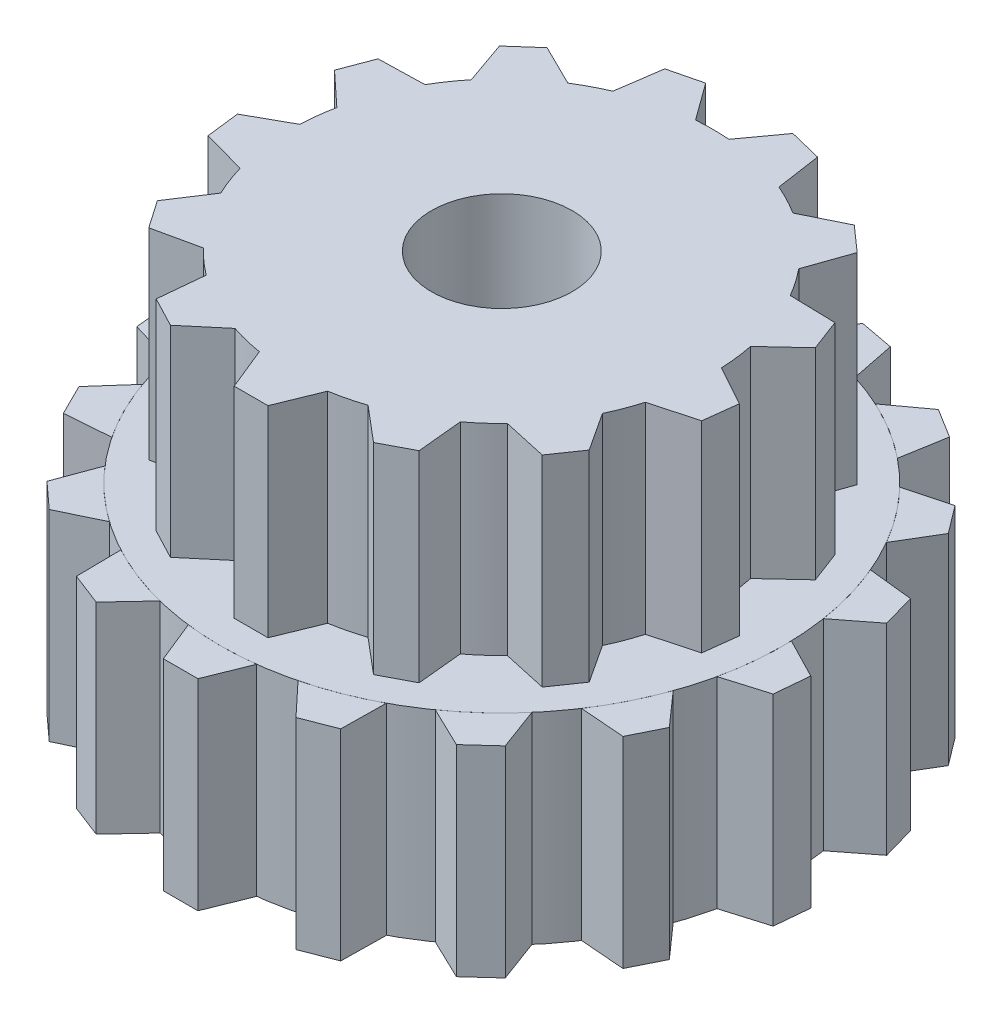
from build123d import *

# Parameters (mm, degrees)
SKETCH1_R            = 3.5
BOSS_EXTRUDE1_DEPTH  = 5
SKETCH12_R           = 10.5
SKETCH12_R_2         = 3.5
BOSS_EXTRUDE6_DEPTH  = 5
BOSS_EXTRUDE9_DEPTH  = 5
CIRPATTERN2_COUNT    = 13
CUT_EXTRUDE1_START   = -10
SKETCH14_R           = 3.5
CUT_EXTRUDE1_DEPTH   = 10
SKETCH17_R           = 10.5
SKETCH17_R_2         = 3.5
BOSS_EXTRUDE10_DEPTH = 5
SKETCH20_R           = 14
SKETCH20_R_2         = 3.5
BOSS_EXTRUDE11_DEPTH = 10
BOSS_EXTRUDE12_DEPTH = 10
CIRPATTERN3_COUNT    = 17
BOSS_EXTRUDE13_DEPTH = 5


with BuildPart() as part:
    # Sketch1 → Boss-Extrude1 (new body)
    with BuildSketch(Plane(origin=(0, 0, 0), x_dir=(1, 0, 0), z_dir=(0, 1, 0))):
        with Locations(Location((0, 0, 0), (0, 0, 270))):
            Circle(SKETCH1_R)
    extrude(amount=BOSS_EXTRUDE1_DEPTH)

    # Sketch14 → Cut-Extrude1 (cut)
    with BuildSketch(Plane(origin=(0, 5, 0), x_dir=(1, 0, 0), z_dir=(0, 1, 0)).offset(CUT_EXTRUDE1_START)):
        with Locations(Location((0, 0, 0), (0, 0, 90))):
            Circle(SKETCH14_R)
    extrude(amount=CUT_EXTRUDE1_DEPTH, mode=Mode.SUBTRACT)


with BuildPart() as body_2:
    # Sketch12 → Boss-Extrude6 (new body)
    with BuildSketch(Plane(origin=(0, 5, 0), x_dir=(-1, 0, 0), z_dir=(0, -1, 0))):
        with Locations(Location((0, 0, 0), (0, 0, 90))):
            Circle(SKETCH12_R)
        with Locations(Location((0, 0, 0), (0, 0, 90))):
            Circle(SKETCH12_R_2, mode=Mode.SUBTRACT)
    extrude(amount=BOSS_EXTRUDE6_DEPTH)



with BuildPart() as body_3:
    # Sketch13 → Boss-Extrude9 (new body)
    with BuildSketch(Plane.XZ):
        with BuildLine():
            Line((1.7, 10.361467078), (0.84, 12.471744064))
            Line((0.84, 12.471744064), (-0.84, 12.471744064))
            Line((-0.84, 12.471744064), (-1.7, 10.361467078))
            ThreePointArc((-1.7, 10.361467078), (0, 10.5), (1.7, 10.361467078))
        make_face()
    extrude(amount=-BOSS_EXTRUDE9_DEPTH)


with BuildPart() as cirpattern2_1:
    # CirPattern2: pattern copy
    add(body_3.part.rotate(Axis((0, 0, 0), (0, 1, 0)), 1 * 360 / CIRPATTERN2_COUNT))


with BuildPart() as cirpattern2_2:
    # CirPattern2: pattern copy
    add(body_3.part.rotate(Axis((0, 0, 0), (0, 1, 0)), 2 * 360 / CIRPATTERN2_COUNT))


with BuildPart() as cirpattern2_3:
    # CirPattern2: pattern copy
    add(body_3.part.rotate(Axis((0, 0, 0), (0, 1, 0)), 3 * 360 / CIRPATTERN2_COUNT))


with BuildPart() as cirpattern2_4:
    # CirPattern2: pattern copy
    add(body_3.part.rotate(Axis((0, 0, 0), (0, 1, 0)), 4 * 360 / CIRPATTERN2_COUNT))


with BuildPart() as cirpattern2_5:
    # CirPattern2: pattern copy
    add(body_3.part.rotate(Axis((0, 0, 0), (0, 1, 0)), 5 * 360 / CIRPATTERN2_COUNT))


with BuildPart() as cirpattern2_6:
    # CirPattern2: pattern copy
    add(body_3.part.rotate(Axis((0, 0, 0), (0, 1, 0)), 6 * 360 / CIRPATTERN2_COUNT))


with BuildPart() as cirpattern2_7:
    # CirPattern2: pattern copy
    add(body_3.part.rotate(Axis((0, 0, 0), (0, 1, 0)), 7 * 360 / CIRPATTERN2_COUNT))


with BuildPart() as cirpattern2_8:
    # CirPattern2: pattern copy
    add(body_3.part.rotate(Axis((0, 0, 0), (0, 1, 0)), 8 * 360 / CIRPATTERN2_COUNT))


with BuildPart() as cirpattern2_9:
    # CirPattern2: pattern copy
    add(body_3.part.rotate(Axis((0, 0, 0), (0, 1, 0)), 9 * 360 / CIRPATTERN2_COUNT))


with BuildPart() as cirpattern2_10:
    # CirPattern2: pattern copy
    add(body_3.part.rotate(Axis((0, 0, 0), (0, 1, 0)), 10 * 360 / CIRPATTERN2_COUNT))


with BuildPart() as cirpattern2_11:
    # CirPattern2: pattern copy
    add(body_3.part.rotate(Axis((0, 0, 0), (0, 1, 0)), 11 * 360 / CIRPATTERN2_COUNT))


with BuildPart() as cirpattern2_12:
    # CirPattern2: pattern copy
    add(body_3.part.rotate(Axis((0, 0, 0), (0, 1, 0)), 12 * 360 / CIRPATTERN2_COUNT))


with BuildPart() as body_2_1:
    add(body_2.part)

    add(body_3.part)  # Boss-Extrude10 merges body 3

    add(cirpattern2_4.part)  # Boss-Extrude10 merges CirPattern2_4

    add(cirpattern2_5.part)  # Boss-Extrude10 merges CirPattern2_5

    add(cirpattern2_6.part)  # Boss-Extrude10 merges CirPattern2_6

    add(cirpattern2_7.part)  # Boss-Extrude10 merges CirPattern2_7

    add(cirpattern2_8.part)  # Boss-Extrude10 merges CirPattern2_8

    add(cirpattern2_9.part)  # Boss-Extrude10 merges CirPattern2_9

    add(cirpattern2_10.part)  # Boss-Extrude10 merges CirPattern2_10

    add(cirpattern2_11.part)  # Boss-Extrude10 merges CirPattern2_11

    add(cirpattern2_12.part)  # Boss-Extrude10 merges CirPattern2_12
    # Sketch17 → Boss-Extrude10 (add)
    # profile 1 of 11: a face of its own
    with BuildSketch(Plane.XZ):
        Circle(SKETCH17_R)
        with Locations(Location((0, 0, 0), (0, 0, 270))):
            Circle(SKETCH17_R_2, mode=Mode.SUBTRACT)
    # profile 2 of 11: a face of its own
    with BuildSketch(Plane.XZ):
        with BuildLine():
            ThreePointArc((-1.7, 10.361467078), (0, 10.5), (1.7, 10.361467078))
            Line((1.7, 10.361467078), (0.84, 12.471744064))
            Line((0.84, 12.471744064), (-0.84, 12.471744064))
            Line((-0.84, 12.471744064), (-1.7, 10.361467078))
        make_face()
    # profile 3 of 11: a face of its own
    with BuildSketch(Plane.XZ):
        with BuildLine():
            ThreePointArc((-6.320489091, 8.384594066), (-4.879593306, 9.297288269), (-3.309938604, 9.964652851))
            Line((-3.309938604, 9.964652851), (-5.052125401, 11.433548396))
            Line((-5.052125401, 11.433548396), (-6.539691524, 10.652813467))
            Line((-6.539691524, 10.652813467), (-6.320489091, 8.384594066))
        make_face()
    # profile 4 of 11: a face of its own
    with BuildSketch(Plane.XZ):
        with BuildLine():
            Line((-10.741218532, 6.393451686), (-9.493030301, 4.486911599))
            ThreePointArc((-9.493030301, 4.486911599), (-8.641330592, 5.964679841), (-7.561610162, 7.285056743))
            Line((-7.561610162, 7.285056743), (-9.786869757, 7.77606458))
            Line((-9.786869757, 7.77606458), (-10.741218532, 6.393451686))
        make_face()
    # profile 5 of 11: a face of its own
    with BuildSketch(Plane.XZ):
        with BuildLine():
            Line((-12.482061819, 0.669427172), (-10.490832673, -0.438668242))
            ThreePointArc((-10.490832673, -0.438668242), (-10.423443178, 1.265635143), (-10.08100796, 2.93654193))
            Line((-10.08100796, 2.93654193), (-12.279560196, 2.337178081))
            Line((-12.279560196, 2.337178081), (-12.482061819, 0.669427172))
        make_face()
    # profile 6 of 11: a face of its own
    with BuildSketch(Plane.XZ):
        with BuildLine():
            Line((-11.363415169, -5.207955039), (-9.085311708, -5.263754475))
            ThreePointArc((-9.085311708, -5.263754475), (-9.817670548, -3.723351314), (-10.290968324, -2.08469925))
            Line((-10.290968324, -2.08469925), (-11.95915138, -3.637127751))
            Line((-11.95915138, -3.637127751), (-11.363415169, -5.207955039))
        make_face()
    # profile 7 of 11: a face of its own
    with BuildSketch(Plane.XZ):
        with BuildLine():
            Line((-7.641547048, -9.892257513), (-5.59845532, -8.882977993))
            ThreePointArc((-5.59845532, -8.882977993), (-6.962787912, -7.859362856), (-8.143391864, -6.628360955))
            Line((-8.143391864, -6.628360955), (-8.899045105, -8.778211447))
            Line((-8.899045105, -8.778211447), (-7.641547048, -9.892257513))
        make_face()
    # profile 8 of 11: a face of its own
    with BuildSketch(Plane.XZ):
        with BuildLine():
            Line((-2.169092589, -12.310363006), (-0.829060287, -10.467218305))
            ThreePointArc((-0.829060287, -10.467218305), (-2.512814475, -10.194889083), (-4.130262466, -9.653545046))
            Line((-4.130262466, -9.653545046), (-3.800274842, -11.90831269))
            Line((-3.800274842, -11.90831269), (-2.169092589, -12.310363006))
        make_face()
    # profile 9 of 11: a face of its own
    with BuildSketch(Plane.XZ):
        with BuildLine():
            Line((0.829060287, -10.467218305), (2.169092589, -12.310363006))
            Line((2.169092589, -12.310363006), (3.800274842, -11.90831269))
            Line((3.800274842, -11.90831269), (4.130262466, -9.653545046))
            ThreePointArc((4.130262466, -9.653545046), (2.512814475, -10.194889083), (0.829060287, -10.467218305))
        make_face()
    # profile 10 of 11: a face of its own
    with BuildSketch(Plane.XZ):
        with BuildLine():
            ThreePointArc((8.143391864, -6.628360955), (6.962787912, -7.859362856), (5.59845532, -8.882977993))
            Line((5.59845532, -8.882977993), (7.641547048, -9.892257513))
            Line((7.641547048, -9.892257513), (8.899045105, -8.778211447))
            Line((8.899045105, -8.778211447), (8.143391864, -6.628360955))
        make_face()
    # profile 11 of 11: a face of its own
    with BuildSketch(Plane.XZ):
        with BuildLine():
            ThreePointArc((10.290968324, -2.08469925), (9.817670548, -3.723351314), (9.085311708, -5.263754475))
            Line((9.085311708, -5.263754475), (11.363415169, -5.207955039))
            Line((11.363415169, -5.207955039), (11.95915138, -3.637127751))
            Line((11.95915138, -3.637127751), (10.290968324, -2.08469925))
        make_face()
    extrude(amount=BOSS_EXTRUDE10_DEPTH)

    # Sketch20 → Boss-Extrude11 (add)
    with BuildSketch(Plane.XZ.offset(5)):
        with Locations(Location((0, 0, 0), (0, 0, 270))):
            Circle(SKETCH20_R)
        with Locations(Location((0, 0, 0), (0, 0, 270))):
            Circle(SKETCH20_R_2, mode=Mode.SUBTRACT)
    extrude(amount=BOSS_EXTRUDE11_DEPTH)


    add(cirpattern2_1.part)  # Boss-Extrude13 merges CirPattern2_1

    add(cirpattern2_2.part)  # Boss-Extrude13 merges CirPattern2_2

    add(cirpattern2_3.part)  # Boss-Extrude13 merges CirPattern2_3
    # Sketch25 → Boss-Extrude13 (add)
    with BuildSketch(Plane.XZ):
        with BuildLine():
            Line((6.320489091, 8.384594066), (6.539691524, 10.652813467))
            Line((6.539691524, 10.652813467), (5.052125401, 11.433548396))
            Line((5.052125401, 11.433548396), (3.309938604, 9.964652851))
            ThreePointArc((3.309938604, 9.964652851), (4.879593306, 9.297288269), (6.320489091, 8.384594066))
        make_face()
        with BuildLine():
            Line((9.493030301, 4.486911599), (10.741218532, 6.393451686))
            Line((10.741218532, 6.393451686), (9.786869757, 7.77606458))
            Line((9.786869757, 7.77606458), (7.561610162, 7.285056743))
            ThreePointArc((7.561610162, 7.285056743), (8.641330592, 5.964679841), (9.493030301, 4.486911599))
        make_face()
        with BuildLine():
            Line((10.490832673, -0.438668242), (12.482061819, 0.669427172))
            Line((12.482061819, 0.669427172), (12.279560196, 2.337178081))
            Line((12.279560196, 2.337178081), (10.08100796, 2.93654193))
            ThreePointArc((10.08100796, 2.93654193), (10.423443178, 1.265635143), (10.490832673, -0.438668242))
        make_face()
    extrude(amount=BOSS_EXTRUDE13_DEPTH)


with BuildPart() as body_5:
    # Sketch21 → Boss-Extrude12 (new body)
    with BuildSketch(Plane.XZ.offset(15)):
        with BuildLine():
            Line((1.7, 13.896402412), (0.86, 15.976870782))
            Line((0.86, 15.976870782), (-0.86, 15.976870782))
            Line((-0.86, 15.976870782), (-1.7, 13.896402412))
            ThreePointArc((-1.7, 13.896402412), (0, 14), (1.7, 13.896402412))
        make_face()
    extrude(amount=-BOSS_EXTRUDE12_DEPTH)


with BuildPart() as cirpattern3_1:
    # CirPattern3: pattern copy
    add(body_5.part.rotate(Axis((0, 0, 0), (0, 1, 0)), 1 * 360 / CIRPATTERN3_COUNT))


with BuildPart() as cirpattern3_2:
    # CirPattern3: pattern copy
    add(body_5.part.rotate(Axis((0, 0, 0), (0, 1, 0)), 2 * 360 / CIRPATTERN3_COUNT))


with BuildPart() as cirpattern3_3:
    # CirPattern3: pattern copy
    add(body_5.part.rotate(Axis((0, 0, 0), (0, 1, 0)), 3 * 360 / CIRPATTERN3_COUNT))


with BuildPart() as cirpattern3_4:
    # CirPattern3: pattern copy
    add(body_5.part.rotate(Axis((0, 0, 0), (0, 1, 0)), 4 * 360 / CIRPATTERN3_COUNT))


with BuildPart() as cirpattern3_5:
    # CirPattern3: pattern copy
    add(body_5.part.rotate(Axis((0, 0, 0), (0, 1, 0)), 5 * 360 / CIRPATTERN3_COUNT))


with BuildPart() as cirpattern3_6:
    # CirPattern3: pattern copy
    add(body_5.part.rotate(Axis((0, 0, 0), (0, 1, 0)), 6 * 360 / CIRPATTERN3_COUNT))


with BuildPart() as cirpattern3_7:
    # CirPattern3: pattern copy
    add(body_5.part.rotate(Axis((0, 0, 0), (0, 1, 0)), 7 * 360 / CIRPATTERN3_COUNT))


with BuildPart() as cirpattern3_8:
    # CirPattern3: pattern copy
    add(body_5.part.rotate(Axis((0, 0, 0), (0, 1, 0)), 8 * 360 / CIRPATTERN3_COUNT))


with BuildPart() as cirpattern3_9:
    # CirPattern3: pattern copy
    add(body_5.part.rotate(Axis((0, 0, 0), (0, 1, 0)), 9 * 360 / CIRPATTERN3_COUNT))


with BuildPart() as cirpattern3_10:
    # CirPattern3: pattern copy
    add(body_5.part.rotate(Axis((0, 0, 0), (0, 1, 0)), 10 * 360 / CIRPATTERN3_COUNT))


with BuildPart() as cirpattern3_11:
    # CirPattern3: pattern copy
    add(body_5.part.rotate(Axis((0, 0, 0), (0, 1, 0)), 11 * 360 / CIRPATTERN3_COUNT))


with BuildPart() as cirpattern3_12:
    # CirPattern3: pattern copy
    add(body_5.part.rotate(Axis((0, 0, 0), (0, 1, 0)), 12 * 360 / CIRPATTERN3_COUNT))


with BuildPart() as cirpattern3_13:
    # CirPattern3: pattern copy
    add(body_5.part.rotate(Axis((0, 0, 0), (0, 1, 0)), 13 * 360 / CIRPATTERN3_COUNT))


with BuildPart() as cirpattern3_14:
    # CirPattern3: pattern copy
    add(body_5.part.rotate(Axis((0, 0, 0), (0, 1, 0)), 14 * 360 / CIRPATTERN3_COUNT))


with BuildPart() as cirpattern3_15:
    # CirPattern3: pattern copy
    add(body_5.part.rotate(Axis((0, 0, 0), (0, 1, 0)), 15 * 360 / CIRPATTERN3_COUNT))


with BuildPart() as cirpattern3_16:
    # CirPattern3: pattern copy
    add(body_5.part.rotate(Axis((0, 0, 0), (0, 1, 0)), 16 * 360 / CIRPATTERN3_COUNT))


solid = Compound([body_2_1.part, body_5.part, cirpattern3_1.part, cirpattern3_2.part, cirpattern3_3.part, cirpattern3_4.part, cirpattern3_5.part, cirpattern3_6.part, cirpattern3_7.part, cirpattern3_8.part, cirpattern3_9.part, cirpattern3_10.part, cirpattern3_11.part, cirpattern3_12.part, cirpattern3_13.part, cirpattern3_14.part, cirpattern3_15.part, cirpattern3_16.part])
